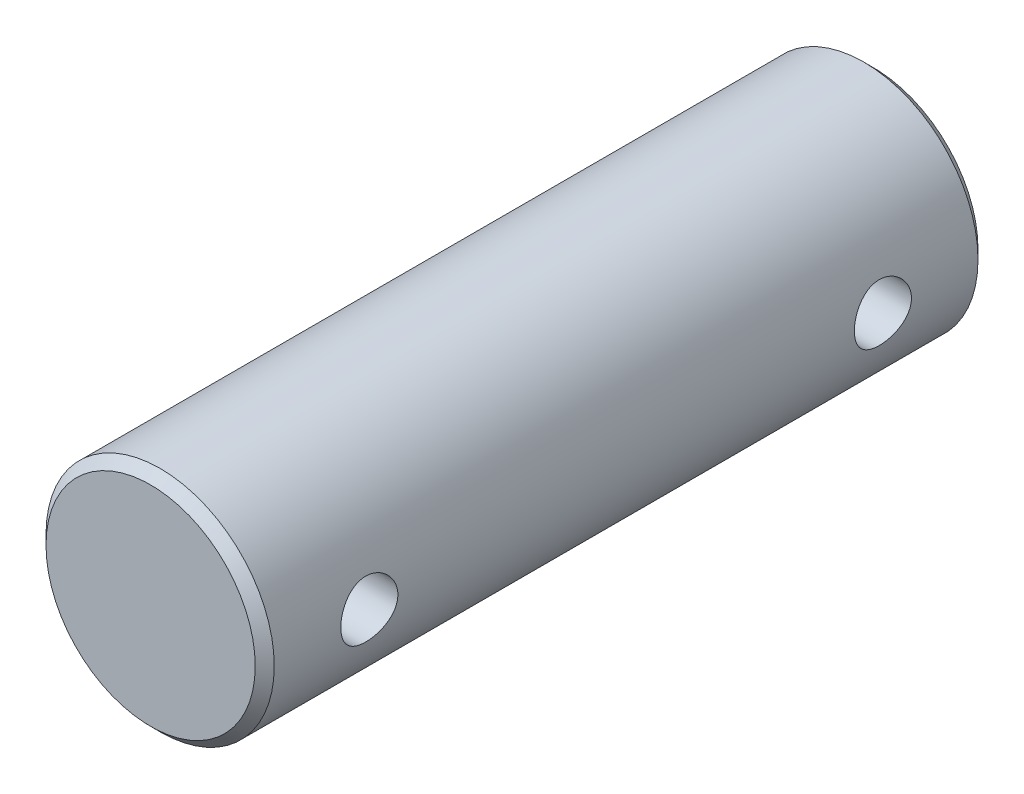
from build123d import *

# Parameters (mm, degrees)
SKETCH1_R           = 6
BOSS_EXTRUDE1_DEPTH = 19
CHAMFER1_SIZE       = 0.5
SKETCH2_R           = 1.5
CUT_EXTRUDE1_DEPTH  = 19


with BuildPart() as part:
    # Sketch1 → Boss-Extrude1 (new, symmetric)
    with BuildSketch(Plane.XY):
        Circle(SKETCH1_R)
    extrude(amount=BOSS_EXTRUDE1_DEPTH, both=True)

    # Chamfer1
    chamfer1_edges = [part.edges().sort_by_distance(p)[0] for p in [
        (-6, 0, -19),
        (-6, 0, 19),
    ]]
    chamfer(chamfer1_edges, length=CHAMFER1_SIZE)

    # Sketch2 → Cut-Extrude1 (cut, symmetric)
    with BuildSketch(Plane(origin=(0, 0, 0), x_dir=(0, 0, -1), z_dir=(1, 0, 0))):
        with Locations(Location((13.5, 0, 0), (0, 0, 180))):
            Circle(SKETCH2_R)
        with Locations(Location((-13.5, 0, 0), (0, 0, 180))):
            Circle(SKETCH2_R)
    extrude(amount=CUT_EXTRUDE1_DEPTH, both=True, mode=Mode.SUBTRACT)


solid = part.part
